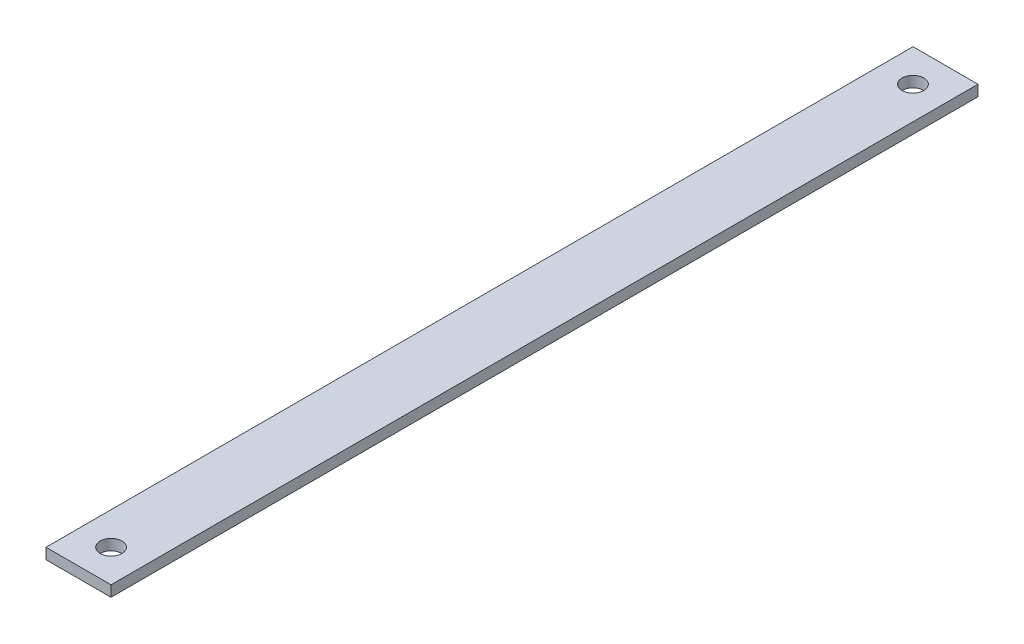
from build123d import *

# Parameters (mm, degrees)
SKETCH1_W           = 19.05
SKETCH1_H           = 254
SKETCH1_R           = 3.1877
BOSS_EXTRUDE1_DEPTH = 3.175


with BuildPart() as part:
    # Sketch1 → Boss-Extrude1 (new body)
    with BuildSketch(Plane(origin=(0, 0, 0), x_dir=(1, 0, 0), z_dir=(0, 1, 0))):
        Rectangle(SKETCH1_W, SKETCH1_H)
        with Locations(Location((0, 117.475, 0), (0, 0, 270))):
            Circle(SKETCH1_R, mode=Mode.SUBTRACT)
        with Locations(Location((0, -117.475, 0), (0, 0, 270))):
            Circle(SKETCH1_R, mode=Mode.SUBTRACT)
    extrude(amount=BOSS_EXTRUDE1_DEPTH)


solid = part.part
